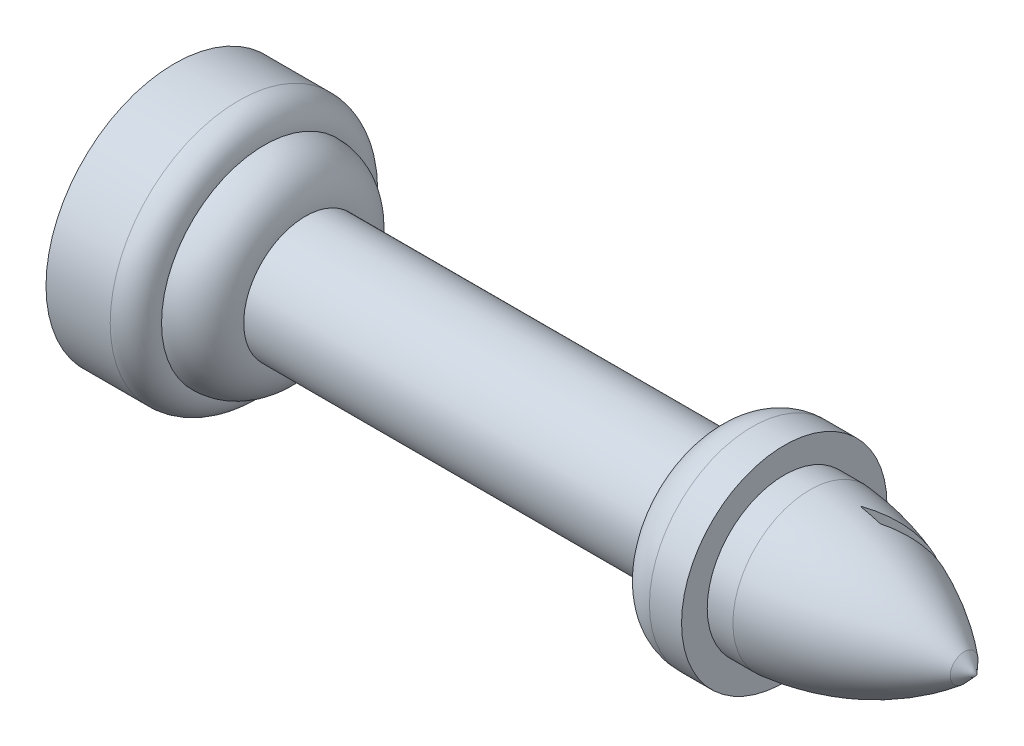
from build123d import *

# Parameters (mm, degrees)
SKETCH_988_W        = 31.6
SKETCH_988_H        = 4.8
SKETCH_988_W_2      = 2.5
SKETCH_988_H_2      = 8
CUT_EXTRUDE_3_DEPTH = 10


with BuildPart() as part:
    # Sketch 1484 → Повернуть1 (revolve)
    with BuildSketch(Plane(origin=(0, 0, 0), x_dir=(1, 0, 0), z_dir=(0, 1, 0)), mode=Mode.PRIVATE) as revolve_1_sk:
        with BuildLine():
            Line((47.5, 6), (49.5, 6))
            ThreePointArc((49.5, 6), (55.875273415, 4.446872371), (61.508920276, 1.082598365))
            Line((61.508920276, 1.082598365), (62.5, 0))
            Line((62.5, 0), (47.5, 0))
            Line((47.5, 0), (47.5, 6))
        make_face()
    revolve(revolve_1_sk.sketch.rotate(Axis((47.5, 0, 0), (1, 0, 0)), 180), axis=Axis((47.5, 0, 0), (1, 0, 0)))

    # Sketch 988 → Повернуть2 (revolve)
    with BuildSketch(Plane(origin=(0, 0, 0), x_dir=(1, 0, 0), z_dir=(0, 1, 0))):
        with Locations((26, 2.4)):
            Rectangle(SKETCH_988_W, SKETCH_988_H)
        with BuildLine():
            ThreePointArc((41.8, 4.8), (42.7372583, 7.0627417), (45, 8))
            Line((45, 8), (45, 0))
            Line((45, 0), (41.8, 0))
            Line((41.8, 0), (41.8, 4.8))
        make_face()
        with Locations((46.25, 4)):
            Rectangle(SKETCH_988_W_2, SKETCH_988_H_2)
    revolve(axis=Axis((41.8, 0, 0), (-1, 0, 0)))

    # Sketch 1791 → Вырез-Вытянуть3 (cut)
    with BuildSketch(Plane(origin=(0, 0, 0), x_dir=(1, 0, 0), z_dir=(0, 1, 0))):
        with BuildLine():
            Line((52, 1.4), (55.280421932, 4.680421932))
            ThreePointArc((55.280421932, 4.680421932), (55.851784453, 4.456474796), (56.416678349, 4.216678349))
            Line((56.416678349, 4.216678349), (53.6, 1.4))
            Line((53.6, 1.4), (52, 1.4))
        make_face()
    cut_extrude_3 = extrude(amount=-CUT_EXTRUDE_3_DEPTH, mode=Mode.SUBTRACT)

    # Зеркальное отражение1: Вырез-Вытянуть3 across plane
    add(cut_extrude_3.mirror(Plane(origin=(47.538581362, 0, 15.912390032), x_dir=(0, 0, 1), z_dir=(0, -1, 0))), mode=Mode.SUBTRACT)


with BuildPart() as body_2:
    # Sketch 159 → Повернуть3 (revolve)
    with BuildSketch(Plane(origin=(0, 0, 0), x_dir=(1, 0, 0), z_dir=(0, 1, 0)), mode=Mode.PRIVATE) as revolve_3_sk:
        Polygon((0, 10), (0, 0), (1, 0), (1, 5.25), (3.5, 5.25), (3.5, 0), (5, 0), (5, 10), align=None)
        with BuildLine():
            ThreePointArc((7, 8), (6.414213562, 9.414213562), (5, 10))
            Line((5, 10), (5, 0))
            Line((5, 0), (7, 0))
            Line((7, 0), (7, 8))
        make_face()
        with BuildLine():
            ThreePointArc((10.2, 4.8), (9.2627417, 7.0627417), (7, 8))
            Line((7, 8), (7, 0))
            Line((7, 0), (10.2, 0))
            Line((10.2, 0), (10.2, 4.8))
        make_face()
    revolve(revolve_3_sk.sketch.rotate(Axis((0, 0, 0), (1, 0, 0)), 180), axis=Axis((0, 0, 0), (1, 0, 0)))


solid = Compound([part.part, body_2.part])
